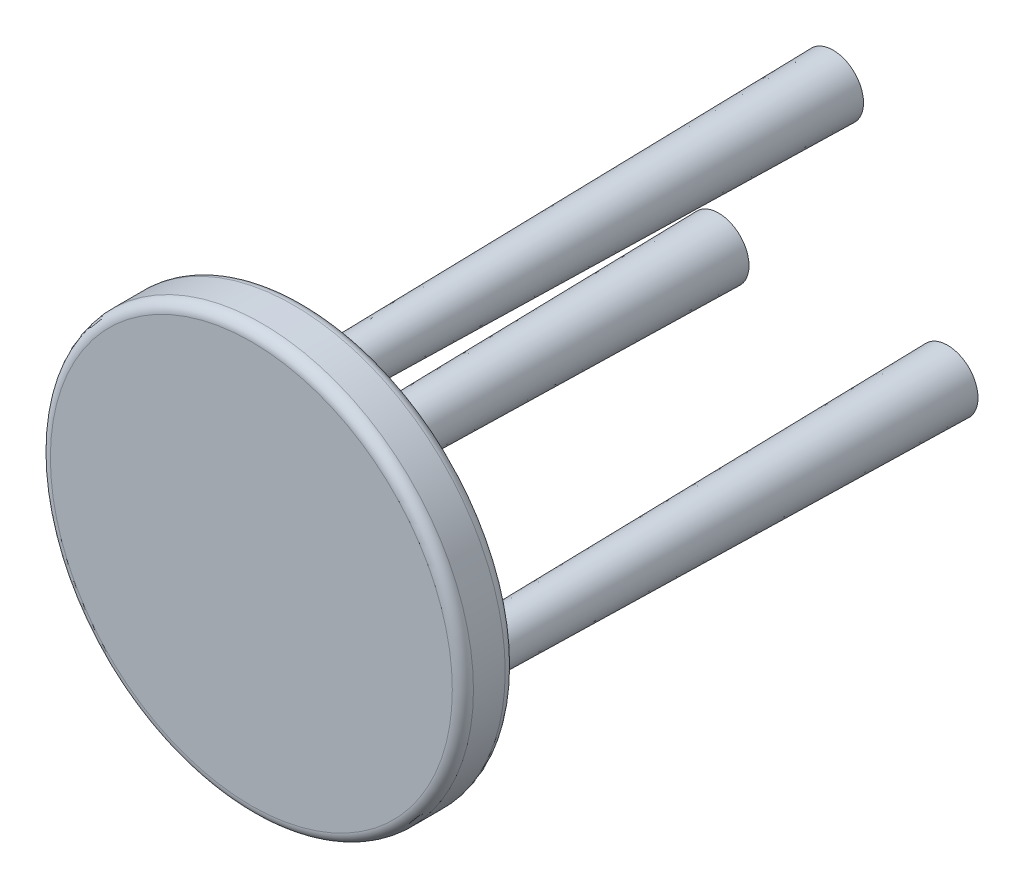
from build123d import *

# Parameters (mm, degrees)
SKETCH1_R                     = 40
BOSS_EXTRUDE1_DEPTH           = 10
SKETCH2_R                     = 4
BOSS_EXTRUDE2_DEPTH           = 100
BOSS_EXTRUDE2_DRAFT           = 1
BOSS_EXTRUDE2_PROFILE_2_DEPTH = 100
BOSS_EXTRUDE2_PROFILE_2_DRAFT = 1
BOSS_EXTRUDE2_PROFILE_3_DEPTH = 100
BOSS_EXTRUDE2_PROFILE_3_DRAFT = 1
FILLET1_R                     = 2
FILLET2_R                     = 2
FILLET3_R                     = 4


with BuildPart() as part:
    # Sketch1 → Boss-Extrude1 (new body)
    with BuildSketch(Plane.XY):
        Circle(SKETCH1_R)
    extrude(amount=BOSS_EXTRUDE1_DEPTH)


with BuildPart() as boss_extrude2_tool:
    # Sketch2 → Boss-Extrude2 (with draft: the straight prism first)
    with BuildSketch(Plane.XY):
        with Locations((0, 25)):
            Circle(SKETCH2_R)
    extrude(amount=-BOSS_EXTRUDE2_DEPTH)
    # Boss-Extrude2: the draft: its side faces are tilted about the plane it starts from
    boss_extrude2_sides = [boss_extrude2_tool.faces().sort_by_distance(p)[0] for p in [
        (-4, 25, -50),
    ]]
    draft(boss_extrude2_sides, Plane.XY, BOSS_EXTRUDE2_DRAFT)


with BuildPart() as part_1:
    add(part.part)

    # Boss-Extrude2: add boss_extrude2_tool
    add(boss_extrude2_tool.part)


with BuildPart() as boss_extrude2_profile_2_tool:
    # Sketch2 → Boss-Extrude2 profile 2 (with draft: the straight prism first)
    with BuildSketch(Plane.XY):
        with Locations((21.650635095, -12.5)):
            Circle(SKETCH2_R)
    extrude(amount=-BOSS_EXTRUDE2_PROFILE_2_DEPTH)
    # Boss-Extrude2 profile 2: the draft: its side faces are tilted about the plane it starts from
    boss_extrude2_profile_2_sides = [boss_extrude2_profile_2_tool.faces().sort_by_distance(p)[0] for p in [
        (17.650635095, -12.5, -50),
    ]]
    draft(boss_extrude2_profile_2_sides, Plane.XY, BOSS_EXTRUDE2_PROFILE_2_DRAFT)


with BuildPart() as part_2:
    add(part_1.part)

    # Boss-Extrude2 profile 2: add boss_extrude2_profile_2_tool
    add(boss_extrude2_profile_2_tool.part)


with BuildPart() as boss_extrude2_profile_3_tool:
    # Sketch2 → Boss-Extrude2 profile 3 (with draft: the straight prism first)
    with BuildSketch(Plane.XY):
        with Locations((-21.650635095, -12.5)):
            Circle(SKETCH2_R)
    extrude(amount=-BOSS_EXTRUDE2_PROFILE_3_DEPTH)
    # Boss-Extrude2 profile 3: the draft: its side faces are tilted about the plane it starts from
    boss_extrude2_profile_3_sides = [boss_extrude2_profile_3_tool.faces().sort_by_distance(p)[0] for p in [
        (-25.650635095, -12.5, -50),
    ]]
    draft(boss_extrude2_profile_3_sides, Plane.XY, BOSS_EXTRUDE2_PROFILE_3_DRAFT)


with BuildPart() as part_3:
    add(part_2.part)

    # Boss-Extrude2 profile 3: add boss_extrude2_profile_3_tool
    add(boss_extrude2_profile_3_tool.part)

    # Fillet1
    fillet1_edges = [part_3.edges().sort_by_distance(p)[0] for p in [
        (-40, 0, 10),
    ]]
    fillet(fillet1_edges, radius=FILLET1_R)

    # Fillet2
    fillet2_edges = [part_3.edges().sort_by_distance(p)[0] for p in [
        (-40, 0, 0),
    ]]
    fillet(fillet2_edges, radius=FILLET2_R)

    # Fillet3
    fillet3_edges = [part_3.edges().sort_by_distance(p)[0] for p in [
        (-25.650635095, -12.5, 0),
        (-4, 25, 0),
        (17.650635095, -12.5, 0),
    ]]
    fillet(fillet3_edges, radius=FILLET3_R)


solid = part_3.part
